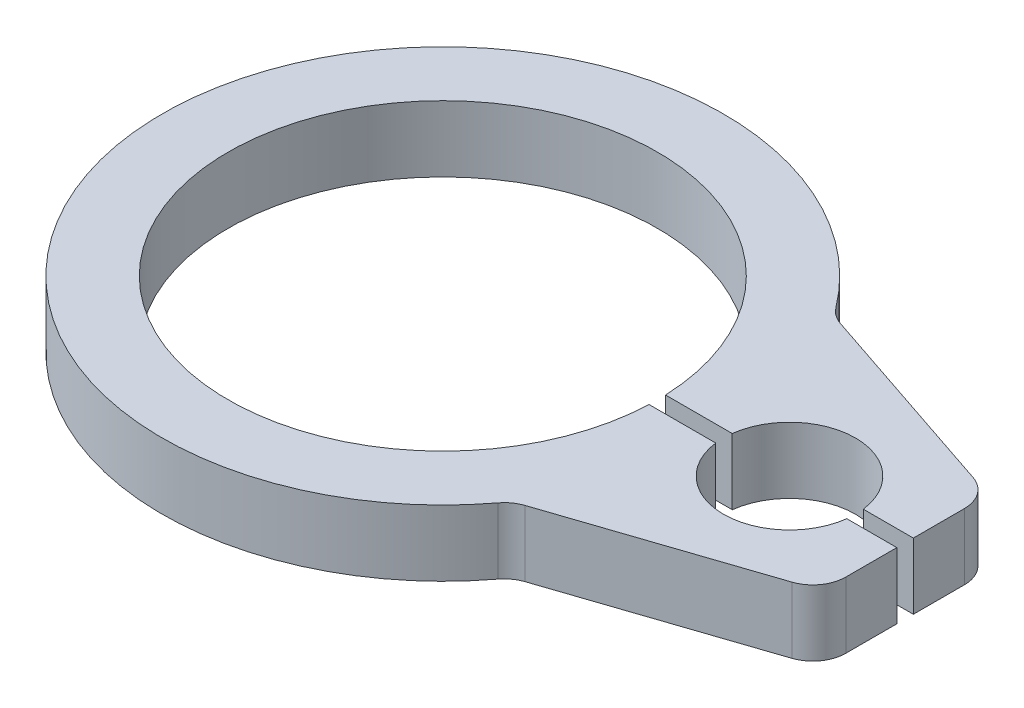
from build123d import *

# Parameters (mm, degrees)
BOSS_EXTRUDE1_DEPTH = 0.4
FILLET1_R           = 0.2


with BuildPart() as part:
    # Sketch1 → Boss-Extrude1 (new body)
    with BuildSketch(Plane(origin=(0, 0, 0), x_dir=(1, 0, 0), z_dir=(0, 1, 0))):
        with BuildLine():
            Line((2.8, 0.5028522), (1.392584, 0.975043488))
            ThreePointArc((1.392584, 0.975043488), (-1.7, 0), (1.392584, -0.975043488))
            Line((1.392584, -0.975043488), (2.8, -0.5028522))
            Line((2.8, -0.5028522), (2.8, -0.05))
            Line((2.8, -0.05), (2.496862697, -0.05))
            ThreePointArc((2.496862697, -0.05), (2.1, -0.4), (1.703137303, -0.05))
            Line((1.703137303, -0.05), (1.299038106, -0.05))
            ThreePointArc((1.299038106, -0.05), (-1.3, 0), (1.299038106, 0.05))
            Line((1.299038106, 0.05), (1.703137303, 0.05))
            ThreePointArc((1.703137303, 0.05), (2.1, 0.4), (2.496862697, 0.05))
            Line((2.496862697, 0.05), (2.8, 0.05))
            Line((2.8, 0.05), (2.8, 0.5028522))
        make_face()
    extrude(amount=BOSS_EXTRUDE1_DEPTH)

    # Fillet1
    fillet1_edges = [part.edges().sort_by_distance(p)[0] for p in [
        (2.8, 0.2, 0.5028522),
        (1.392584, 0.2, 0.975043488),
        (1.392584, 0.2, -0.975043488),
        (2.8, 0.2, -0.5028522),
    ]]
    fillet(fillet1_edges, radius=FILLET1_R)


solid = part.part
